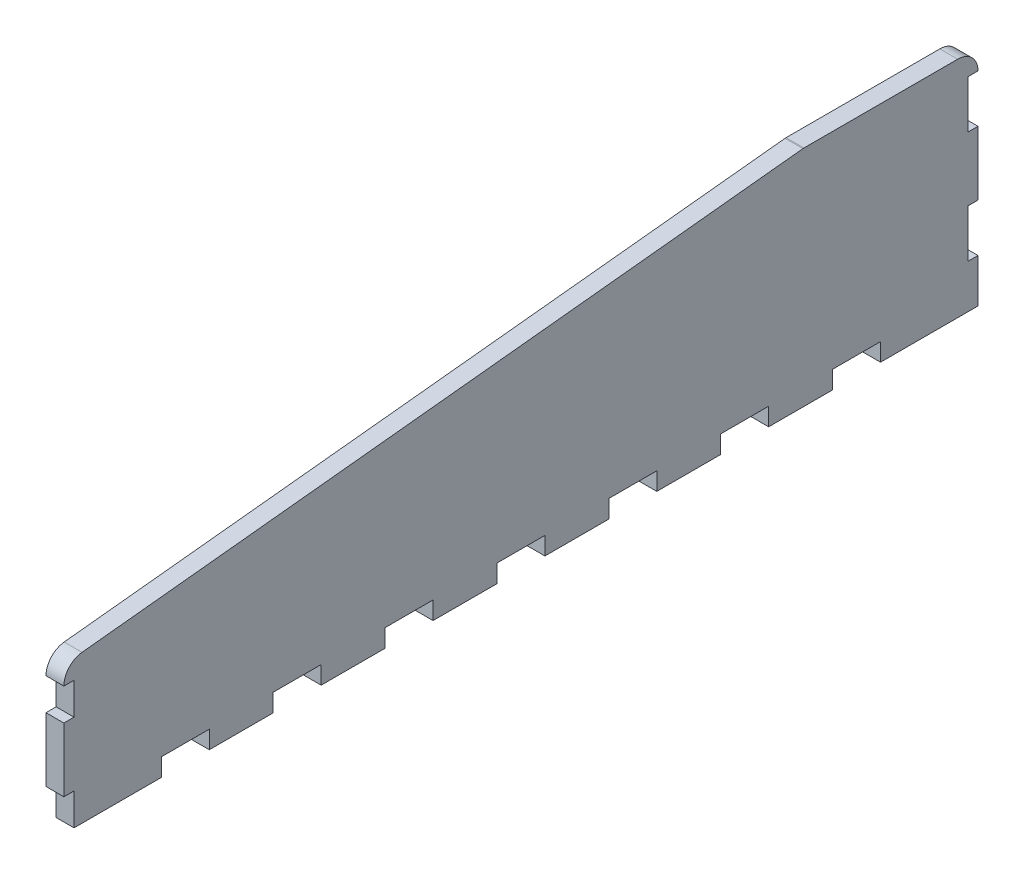
from build123d import *

# Parameters (mm, degrees)
BOSS_EXTRUDE1_DEPTH = 5.588


with BuildPart() as part:
    # Sketch26 → Boss-Extrude1 (new body)
    with BuildSketch(Plane(origin=(0, 0, 0), x_dir=(0, 0, -1), z_dir=(1, 0, 0))):
        with BuildLine():
            Line((-3.175, -205.30682867), (-33.668926811, -205.30682867))
            Line((-33.668926811, -205.30682867), (-33.668926811, -199.71882867))
            Line((-33.668926811, -199.71882867), (-48.668926811, -199.71882867))
            Line((-48.668926811, -199.71882867), (-48.668926811, -205.30682867))
            Line((-48.668926811, -205.30682867), (-68.668926811, -205.30682867))
            Line((-68.668926811, -205.30682867), (-68.668926811, -199.71882867))
            Line((-68.668926811, -199.71882867), (-83.668926811, -199.71882867))
            Line((-83.668926811, -199.71882867), (-83.668926811, -205.30682867))
            Line((-83.668926811, -205.30682867), (-103.668926811, -205.30682867))
            Line((-103.668926811, -205.30682867), (-103.668926811, -199.71882867))
            Line((-103.668926811, -199.71882867), (-118.668926811, -199.71882867))
            Line((-118.668926811, -199.71882867), (-118.668926811, -205.30682867))
            Line((-118.668926811, -205.30682867), (-138.668926811, -205.30682867))
            Line((-138.668926811, -205.30682867), (-138.668926811, -199.71882867))
            Line((-138.668926811, -199.71882867), (-153.668926811, -199.71882867))
            Line((-153.668926811, -199.71882867), (-153.668926811, -205.30682867))
            Line((-153.668926811, -205.30682867), (-173.668926811, -205.30682867))
            Line((-173.668926811, -205.30682867), (-173.668926811, -199.71882867))
            Line((-173.668926811, -199.71882867), (-188.668926811, -199.71882867))
            Line((-188.668926811, -199.71882867), (-188.668926811, -205.30682867))
            Line((-188.668926811, -205.30682867), (-208.668926811, -205.30682867))
            Line((-208.668926811, -205.30682867), (-208.668926811, -199.71882867))
            Line((-208.668926811, -199.71882867), (-223.668926811, -199.71882867))
            Line((-223.668926811, -199.71882867), (-223.668926811, -205.30682867))
            Line((-223.668926811, -205.30682867), (-243.668926811, -205.30682867))
            Line((-243.668926811, -205.30682867), (-243.668926811, -199.71882867))
            Line((-243.668926811, -199.71882867), (-258.668926811, -199.71882867))
            Line((-258.668926811, -199.71882867), (-258.668926811, -205.30682867))
            Line((-258.668926811, -205.30682867), (-285.987853622, -205.30682867))
            Line((-285.987853622, -205.30682867), (-285.987853622, -195.30682867))
            Line((-285.987853622, -195.30682867), (-289.162853622, -195.30682867))
            Line((-289.162853622, -195.30682867), (-289.162853622, -175.30682867))
            Line((-289.162853622, -175.30682867), (-285.987853622, -175.30682867))
            Line((-285.987853622, -175.30682867), (-285.987853622, -165.30682867))
            Line((-285.987853622, -165.30682867), (-289.162853622, -165.30682867))
            ThreePointArc((-289.162853622, -165.30682867), (-287.531823263, -161.057849319), (-283.476609363, -158.991614634))
            Line((-283.476609363, -158.991614634), (-57.959024207, -135.288761307))
            ThreePointArc((-57.959024207, -135.288761307), (-57.802446686, -135.276438389), (-57.645438817, -135.272326993))
            Line((-57.645438817, -135.272326993), (-9.525, -135.272326993))
            ThreePointArc((-9.525, -135.272326993), (-5.034871939, -137.132198933), (-3.175, -141.622326993))
            Line((-3.175, -141.622326993), (-6.35, -141.622326993))
            Line((-6.35, -141.622326993), (-6.35, -156.622326993))
            Line((-6.35, -156.622326993), (-3.175, -156.622326993))
            Line((-3.175, -156.622326993), (-3.175, -176.622326993))
            Line((-3.175, -176.622326993), (-6.35, -176.622326993))
            Line((-6.35, -176.622326993), (-6.35, -191.622326993))
            Line((-6.35, -191.622326993), (-3.175, -191.622326993))
            Line((-3.175, -191.622326993), (-3.175, -205.30682867))
        make_face()
    extrude(amount=BOSS_EXTRUDE1_DEPTH)


solid = part.part
